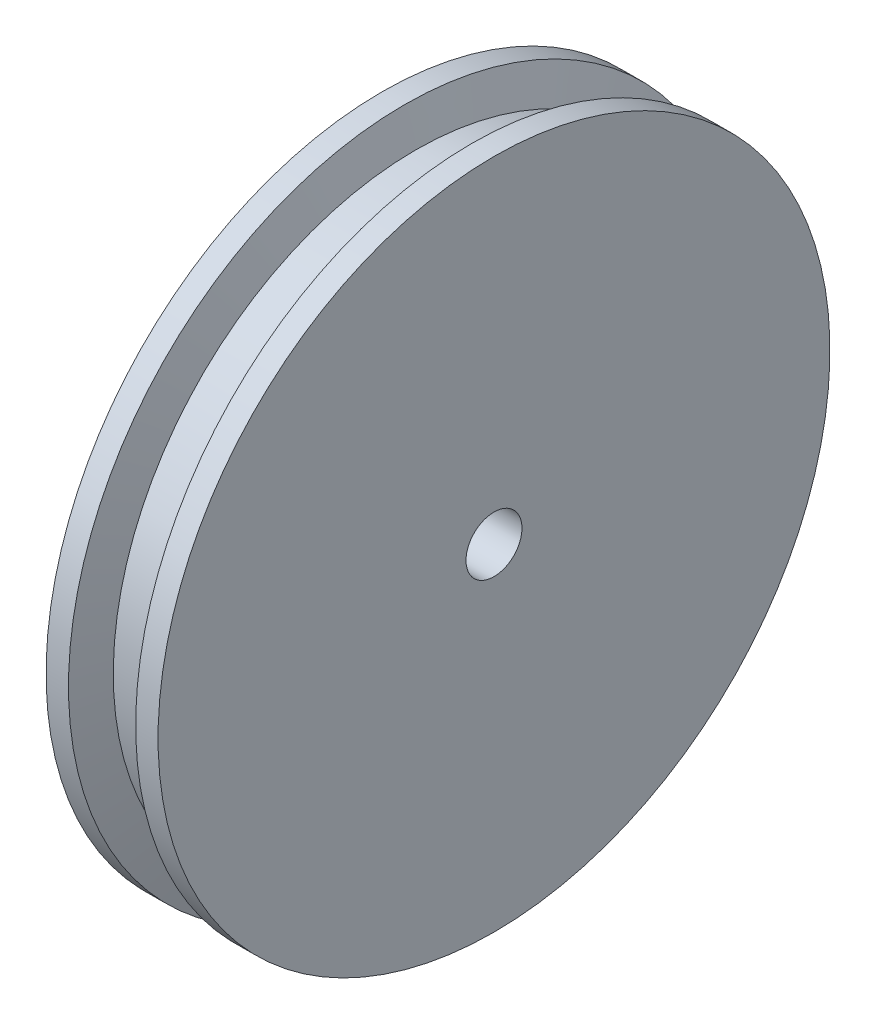
from build123d import *

# Parameters (mm, degrees)
SKETCH4_R          = 2.5
CUT_EXTRUDE2_DEPTH = 10


with BuildPart() as part:
    # Sketch3 → Revolve1 (revolve)
    with BuildSketch(Plane.XY):
        Polygon((0, 0), (0, 30), (2, 30), (3, 27), (7, 27), (8, 30), (10, 30), (10, 0), align=None)
    revolve(axis=Axis((10, 0, 0), (-1, 0, 0)))

    # Sketch4 → Cut-Extrude2 (cut)
    with BuildSketch(Plane(origin=(10, 0, 0), x_dir=(0, 0, -1), z_dir=(1, 0, 0))):
        with Locations(Location((0, 0, 0), (0, 0, 90))):
            Circle(SKETCH4_R)
    extrude(amount=-CUT_EXTRUDE2_DEPTH, mode=Mode.SUBTRACT)


solid = part.part
